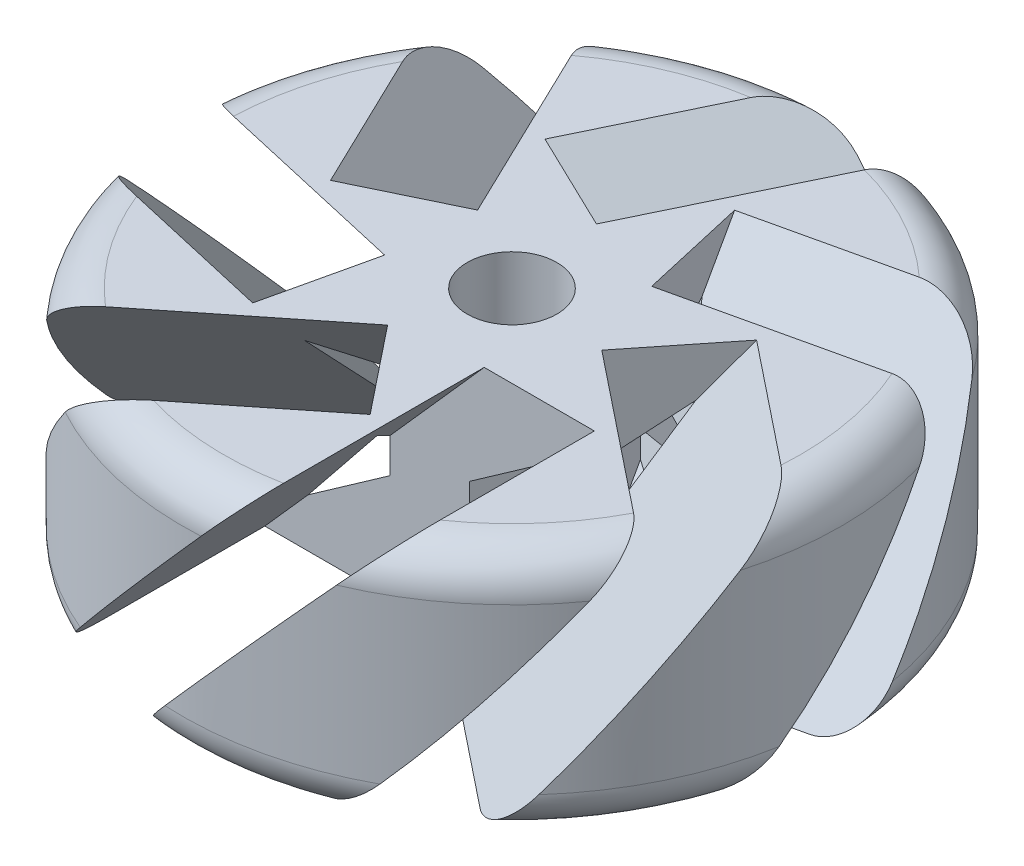
from build123d import *

# Parameters (mm, degrees)
SKETCH1_R                = 25.4
BOSS_EXTRUDE1_DEPTH      = 19.05
F_5_16_24_TAPPED_HOLE1_D = 6.9088
FILLET1_R                = 3.175
CUT_EXTRUDE1_DEPTH       = 22.225
CIRPATTERN1_COUNT        = 7


with BuildPart() as part:
    # Sketch1 → Boss-Extrude1 (new body)
    with BuildSketch(Plane(origin=(0, 0, 0), x_dir=(1, 0, 0), z_dir=(0, 1, 0))):
        with Locations(Location((0, 0, 0), (0, 0, 90))):
            Circle(SKETCH1_R)
    extrude(amount=BOSS_EXTRUDE1_DEPTH)

    # 5/16-24 Tapped Hole1 (through all)
    with Locations(Plane(origin=(0, 19.05, 0), x_dir=(1, 0, 0), z_dir=(0, 1, 0))):
        with Locations((0, 0)):
            Hole(F_5_16_24_TAPPED_HOLE1_D / 2)

    # Fillet1
    fillet1_edges = [part.edges().sort_by_distance(p)[0] for p in [
        (0, 0, 25.4),
        (0, 19.05, 25.4),
    ]]
    fillet(fillet1_edges, radius=FILLET1_R)

    # Sketch5 → Cut-Extrude1 (cut)
    with BuildSketch(Plane.XY.offset(28.575)):
        Polygon((7.950977632, 23.265363157), (-12.7, 0), (-7.950977632, -4.215363157), (12.7, 19.05), align=None)
    cut_extrude1 = extrude(amount=-CUT_EXTRUDE1_DEPTH, mode=Mode.SUBTRACT)

    # CirPattern1: Cut-Extrude1 ×7 about axis
    cirpattern1_axis = Axis((0, 0, 0), (0, 1, 0))
    for i in range(1, CIRPATTERN1_COUNT):
        add(cut_extrude1.rotate(cirpattern1_axis, i * 360 / CIRPATTERN1_COUNT), mode=Mode.SUBTRACT)


solid = part.part
